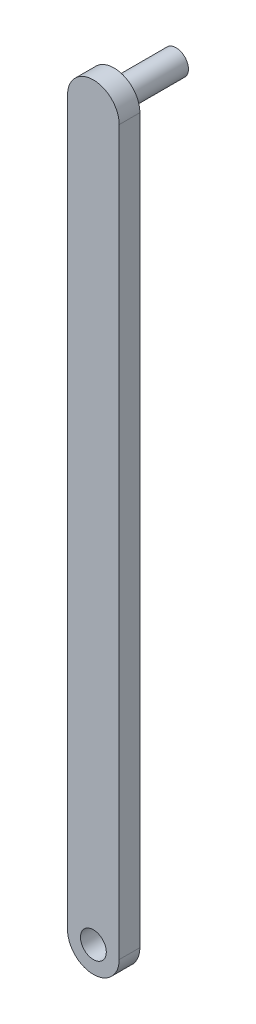
from build123d import *

# Parameters (mm, degrees)
SKETCH1_R           = 1.5875
BOSS_EXTRUDE1_DEPTH = 2.54
BOSS_EXTRUDE2_START = -2.54
SKETCH2_R           = 1.524
BOSS_EXTRUDE2_DEPTH = 7.62
SKETCH3_R           = 1.5875
BOSS_EXTRUDE3_DEPTH = 2.54


with BuildPart() as part:
    # Sketch1 → Boss-Extrude1 (new body)
    with BuildSketch(Plane.XY):
        with BuildLine():
            Line((-3.175, 0), (-3.175, -88.9))
            ThreePointArc((-3.175, -88.9), (0, -92.075), (3.175, -88.9))
            Line((3.175, -88.9), (3.175, 0))
            ThreePointArc((3.175, 0), (0, 3.175), (-3.175, 0))
        make_face()
        Circle(SKETCH1_R, mode=Mode.SUBTRACT)
        with Locations((0, -88.9)):
            Circle(SKETCH1_R, mode=Mode.SUBTRACT)
    extrude(amount=BOSS_EXTRUDE1_DEPTH)

    # Sketch3 → Boss-Extrude3 (add)
    with BuildSketch(Plane.XY):
        Circle(SKETCH3_R)
    extrude(amount=BOSS_EXTRUDE3_DEPTH)


with BuildPart() as body_2:
    # Sketch2 → Boss-Extrude2 (new body)
    with BuildSketch(Plane.XY.offset(2.54).offset(BOSS_EXTRUDE2_START)):
        Circle(SKETCH2_R)
    extrude(amount=-BOSS_EXTRUDE2_DEPTH)


solid = Compound([part.part, body_2.part])
